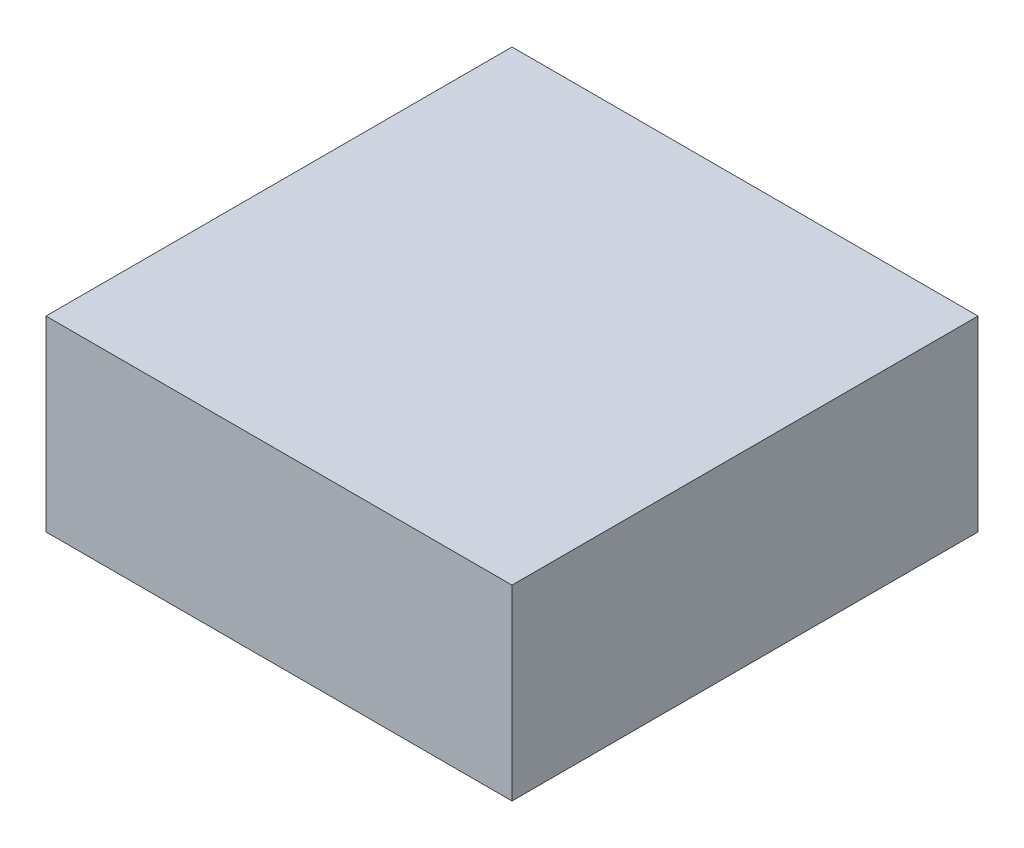
from build123d import *

# Parameters (mm, degrees)
SKETCH1_W           = 7.85
SKETCH1_H           = 7.85
BOSS_EXTRUDE1_DEPTH = 3.15
SHELL1_T            = -1.5


with BuildPart() as part:
    # Sketch1 → Boss-Extrude1 (new body)
    with BuildSketch(Plane(origin=(0, 0, 0), x_dir=(1, 0, 0), z_dir=(0, 1, 0))):
        Rectangle(SKETCH1_W, SKETCH1_H)
    extrude(amount=-BOSS_EXTRUDE1_DEPTH)

    # Shell1
    shell1_openings = [part.faces().sort_by_distance(p)[0] for p in [
        (0, -3.15, 0),
    ]]
    offset(amount=SHELL1_T, openings=shell1_openings, kind=Kind.INTERSECTION)


solid = part.part
